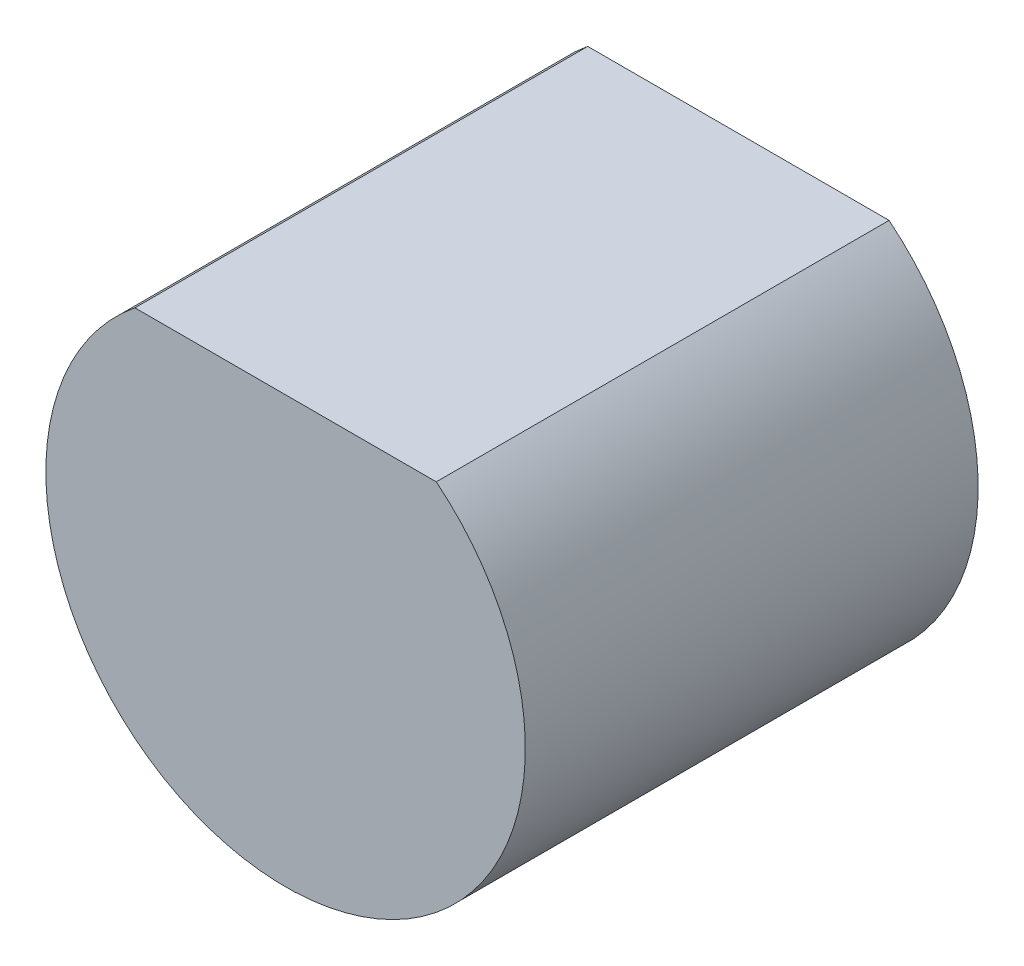
from build123d import *

# Parameters (mm, degrees)
SKETCH1_R           = 2.286
BOSS_EXTRUDE1_DEPTH = 4.318
CUT_EXTRUDE1_START  = -4.318
CUT_EXTRUDE1_DEPTH  = 4.318


with BuildPart() as part:
    # Sketch1 → Boss-Extrude1 (new body)
    with BuildSketch(Plane.XY):
        Circle(SKETCH1_R)
    extrude(amount=BOSS_EXTRUDE1_DEPTH)

    # Sketch2 → Cut-Extrude1 (cut)
    with BuildSketch(Plane.XY.offset(4.318).offset(CUT_EXTRUDE1_START)):
        with BuildLine():
            Line((-1.436840979, 1.778), (1.436840979, 1.778))
            ThreePointArc((1.436840979, 1.778), (0, 2.286), (-1.436840979, 1.778))
        make_face()
    extrude(amount=CUT_EXTRUDE1_DEPTH, mode=Mode.SUBTRACT)


solid = part.part
